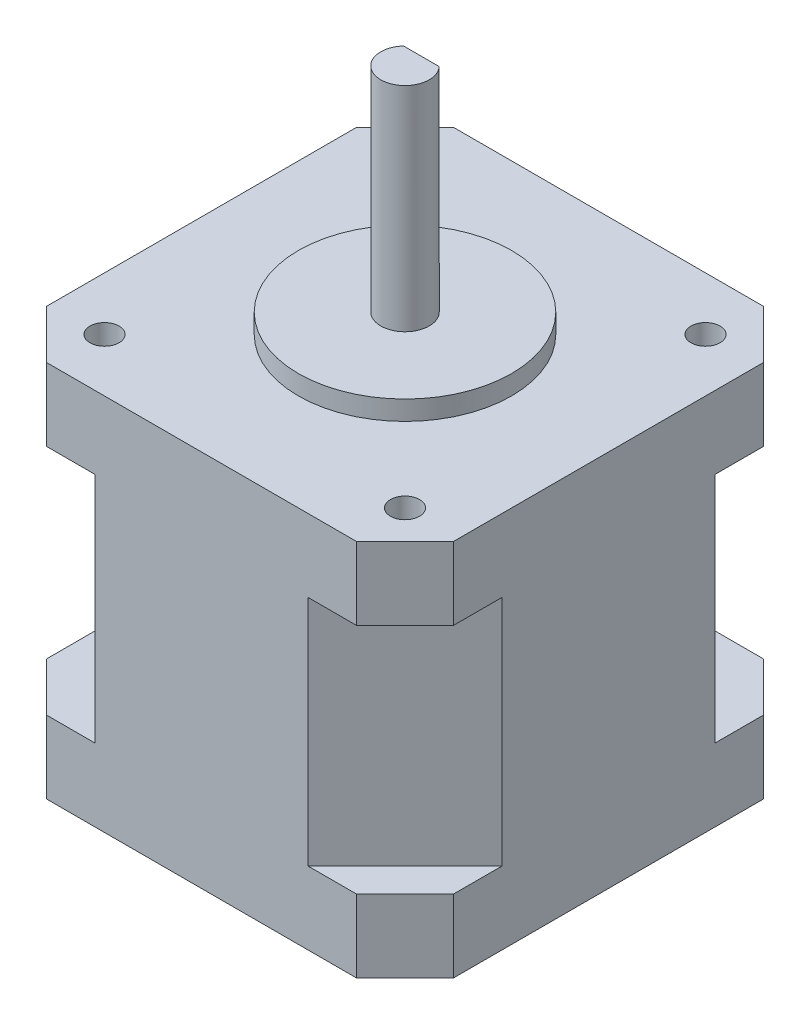
from build123d import *

# Parameters (mm, degrees)
EXTRUDE_1_DEPTH     = 7.5
EXTRUDE_2_DEPTH     = 24
EXTRUDE_3_DEPTH     = 7.5
SKETCH_4_R          = 11
EXTRUDE_4_DEPTH     = 2
SKETCH_5_R          = 2.5
EXTRUDE_5_DEPTH     = 22
SKETCH_6_W          = 7.205665958
SKETCH_6_H          = 1.954366946
CUT_EXTRUDE_1_DEPTH = 16
SKETCH_7_R          = 1.5
CUT_EXTRUDE_2_DEPTH = 5


with BuildPart() as part:
    # 草图1 → 凸台-拉伸1 (new body)
    with BuildSketch(Plane(origin=(0, 0, 0), x_dir=(1, 0, 0), z_dir=(0, 1, 0))):
        Polygon((-21, 16), (-16, 21), (16, 21), (21, 16), (21, -16), (16, -21), (-16, -21), (-21, -16), align=None)
    extrude(amount=-EXTRUDE_1_DEPTH)

    # 草图2 → 凸台-拉伸2 (add)
    with BuildSketch(Plane.XZ.offset(7.5)):
        Polygon((-21, 11), (-11, 21), (11, 21), (21, 11), (21, -11), (11, -21), (-11, -21), (-21, -11), align=None)
    extrude(amount=EXTRUDE_2_DEPTH)

    # 草图3 → 凸台-拉伸3 (add)
    with BuildSketch(Plane.XZ.offset(31.5)):
        Polygon((-21, 16), (-16, 21), (16, 21), (21, 16), (21, -16), (16, -21), (-16, -21), (-21, -16), align=None)
    extrude(amount=EXTRUDE_3_DEPTH)

    # 草图4 → 凸台-拉伸4 (add)
    with BuildSketch(Plane(origin=(0, 0, 0), x_dir=(1, 0, 0), z_dir=(0, 1, 0))):
        with Locations(Location((0, 0, 0), (0, 0, 270))):
            Circle(SKETCH_4_R)
    extrude(amount=EXTRUDE_4_DEPTH)

    # 草图5 → 凸台-拉伸5 (add)
    with BuildSketch(Plane(origin=(0, 2, 0), x_dir=(1, 0, 0), z_dir=(0, 1, 0))):
        with Locations(Location((0, 0, 0), (0, 0, 270))):
            Circle(SKETCH_5_R)
    extrude(amount=EXTRUDE_5_DEPTH)

    # 草图6 → 切除-拉伸1 (cut)
    with BuildSketch(Plane(origin=(0, 24, 0), x_dir=(1, 0, 0), z_dir=(0, 1, 0))):
        with Locations((0.108418899, 2.670655674)):
            Rectangle(SKETCH_6_W, SKETCH_6_H)
    extrude(amount=-CUT_EXTRUDE_1_DEPTH, mode=Mode.SUBTRACT)

    # 草图7 → 切除-拉伸2 (cut)
    with BuildSketch(Plane(origin=(0, 0, 0), x_dir=(1, 0, 0), z_dir=(0, 1, 0))):
        with Locations(Location((-15.5, 15.5, 0), (0, 0, 270))):
            Circle(SKETCH_7_R)
        with Locations(Location((15.5, 15.5, 0), (0, 0, 270))):
            Circle(SKETCH_7_R)
        with Locations(Location((15.5, -15.5, 0), (0, 0, 270))):
            Circle(SKETCH_7_R)
        with Locations(Location((-15.5, -15.5, 0), (0, 0, 270))):
            Circle(SKETCH_7_R)
    extrude(amount=-CUT_EXTRUDE_2_DEPTH, mode=Mode.SUBTRACT)


solid = part.part
